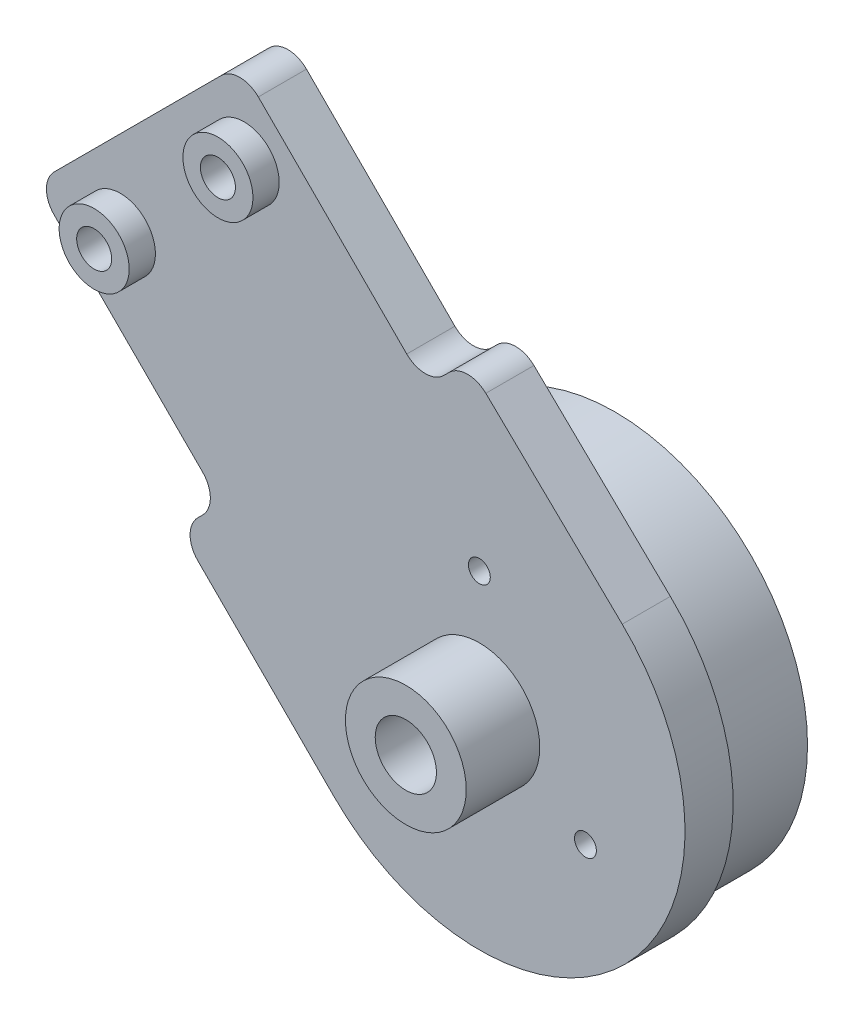
from build123d import *

# Parameters (mm, degrees)
SKETCH6_R           = 10
SKETCH6_R_2         = 1
BOSS_EXTRUDE1_DEPTH = 2.75
BOSS_EXTRUDE2_START = -1
SKETCH7_R           = 10
BOSS_EXTRUDE2_DEPTH = 1
BOSS_EXTRUDE3_START = 5
SKETCH9_R           = 11
SKETCH9_R_2         = 10
BOSS_EXTRUDE3_DEPTH = 5
FILLET1_R           = 1.5
SKETCH10_R          = 2
SKETCH10_R_2        = 1
BOSS_EXTRUDE4_DEPTH = 1.5
SKETCH11_R          = 1.75
CUT_EXTRUDE1_DEPTH  = 7.5
SKETCH13_R          = 3.45
SKETCH13_R_2        = 1.75
BOSS_EXTRUDE6_DEPTH = 4.2
SKETCH14_R          = 0.625
CUT_EXTRUDE3_DEPTH  = 4.2


with BuildPart() as part:
    # Sketch6 → Boss-Extrude1 (new body)
    with BuildSketch(Plane.XY):
        with BuildLine():
            Line((86.312119508, 25.202992473), (74.644857618, 13.535730583))
            Line((74.644857618, 13.535730583), (85.251459336, 2.929128866))
            Line((85.251459336, 2.929128866), (82.852660556, 0.530330086))
            Line((82.852660556, 0.530330086), (91.691495321, -8.308504679))
            ThreePointArc((91.691495321, -8.308504679), (108.38019234, -8.236193074), (108.163262955, 8.451250672))
            Line((108.163262955, 8.451250672), (99.304494429, 17.008144763))
            Line((99.304494429, 17.008144763), (96.918721226, 14.596390755))
            Line((96.918721226, 14.596390755), (86.312119508, 25.202992473))
        make_face()
        with Locations((100, 0)):
            Circle(SKETCH6_R, mode=Mode.SUBTRACT)
        with Locations((79.493903346, 13.435028843)):
            Circle(SKETCH6_R_2, mode=Mode.SUBTRACT)
        with Locations((86.564971157, 20.506096654)):
            Circle(SKETCH6_R_2, mode=Mode.SUBTRACT)
    extrude(amount=BOSS_EXTRUDE1_DEPTH)

    # Sketch7 → Boss-Extrude2 (add)
    with BuildSketch(Plane.XY.offset(2.75).offset(BOSS_EXTRUDE2_START)):
        with Locations((100, 0)):
            Circle(SKETCH7_R)
    extrude(amount=BOSS_EXTRUDE2_DEPTH)

    # Sketch9 → Boss-Extrude3 (add)
    with BuildSketch(Plane(origin=(0, 0, 0), x_dir=(-1, 0, 0), z_dir=(0, 0, -1)).offset(BOSS_EXTRUDE3_START)):
        with Locations(Location((-100, 0, 0), (0, 0, 180))):
            Circle(SKETCH9_R)
        with Locations((-100, 0)):
            Circle(SKETCH9_R_2, mode=Mode.SUBTRACT)
    extrude(amount=-BOSS_EXTRUDE3_DEPTH)

    # Fillet1
    fillet1_edges = [part.edges().sort_by_distance(p)[0] for p in [
        (82.852660556, 0.530330086, 1.375),
        (85.251459336, 2.929128866, 1.375),
        (74.644857618, 13.535730583, 1.375),
        (86.312119508, 25.202992473, 1.375),
        (96.918721226, 14.596390755, 1.375),
        (99.304494429, 17.008144763, 1.375),
    ]]
    fillet(fillet1_edges, radius=FILLET1_R)

    # Sketch10 → Boss-Extrude4 (add)
    # profile 1 of 2: a face of its own
    with BuildSketch(Plane.XY.offset(2.75)):
        with Locations((79.493903346, 13.435028843)):
            Circle(SKETCH10_R)
        with Locations((79.493903346, 13.435028843)):
            Circle(SKETCH10_R_2, mode=Mode.SUBTRACT)
    # profile 2 of 2: a face of its own
    with BuildSketch(Plane.XY.offset(2.75)):
        with Locations((86.564971157, 20.506096654)):
            Circle(SKETCH10_R)
        with Locations((86.564971157, 20.506096654)):
            Circle(SKETCH10_R_2, mode=Mode.SUBTRACT)
    extrude(amount=BOSS_EXTRUDE4_DEPTH)

    # Sketch11 → Cut-Extrude1 (cut)
    with BuildSketch(Plane.XY):
        with Locations(Location((100, 0, 0), (0, 0, 180))):
            Circle(SKETCH11_R)
    extrude(amount=CUT_EXTRUDE1_DEPTH, mode=Mode.SUBTRACT)

    # Sketch13 → Boss-Extrude6 (add)
    with BuildSketch(Plane.XY.offset(2.75)):
        with Locations((100, 0)):
            Circle(SKETCH13_R)
        with Locations(Location((100, 0, 0), (0, 0, 180))):
            Circle(SKETCH13_R_2, mode=Mode.SUBTRACT)
    extrude(amount=BOSS_EXTRUDE6_DEPTH)

    # Sketch14 → Cut-Extrude3 (cut)
    with BuildSketch(Plane.XY.offset(2.75)):
        with Locations((100, 7)):
            Circle(SKETCH14_R)
        with Locations((106.062177826, -3.5)):
            Circle(SKETCH14_R)
        with Locations((93.937822174, -3.5)):
            Circle(SKETCH14_R)
    extrude(amount=-CUT_EXTRUDE3_DEPTH, mode=Mode.SUBTRACT)


solid = part.part
